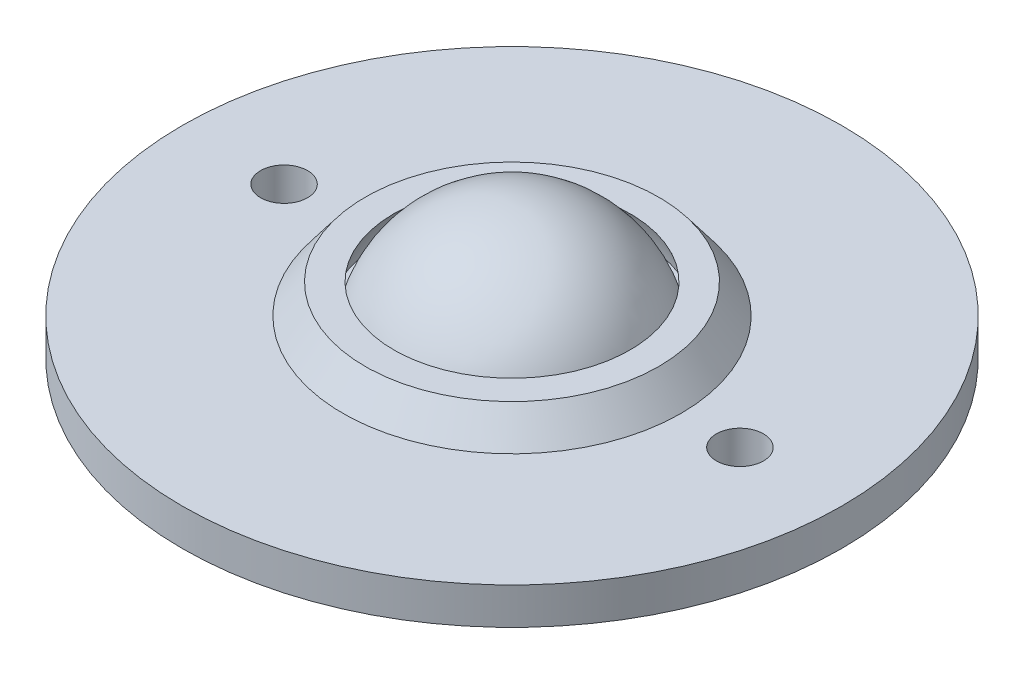
from build123d import *

# Parameters (mm, degrees)
SKETCH_2_R          = 1.6
CUT_EXTRUDE_1_DEPTH = 10


with BuildPart() as part:
    # 草图1 → 旋转5 (revolve)
    with BuildSketch(Plane.XY):
        with BuildLine():
            Line((-11.5, 0.961485209), (-22.420203846, 0.961485209))
            Line((-22.420203846, 0.961485209), (-22.420203846, -1.538514791))
            Line((-22.420203846, -1.538514791), (-12.404957567, -1.538514791))
            ThreePointArc((-12.404957567, -1.538514791), (-8.277033439, -9.367001518), (0, -12.5))
            Line((0, -12.5), (0, 0.961485209))
            Line((0, 0.961485209), (-8.348478365, 0.961485209))
            Line((-8.348478365, 0.961485209), (-8.760960883, 0.961485209))
            ThreePointArc((-8.760960883, 0.961485209), (-8.455804212, 1.983114098), (-8.031969161, 2.961485209))
            Line((-8.031969161, 2.961485209), (-9.978754751, 2.961485209))
            Line((-9.978754751, 2.961485209), (-11.5, 0.961485209))
        make_face()
    revolve(axis=Axis((0, 0, 0), (0, 1, 0)))

    # 草图1<6> → 旋转8 (revolve)
    with BuildSketch(Plane.XY):
        with BuildLine():
            Line((0, 7.5), (0, 0.961485209))
            Line((0, 0.961485209), (8.348478365, 0.961485209))
            ThreePointArc((8.348478365, 0.961485209), (5.302104928, 5.670819301), (0, 7.5))
        make_face()
    revolve(axis=Axis((0, 0, 0), (0, 1, 0)))

    # 草图2 → 切除-拉伸1 (cut)
    with BuildSketch(Plane(origin=(0, 0.961485209, 0), x_dir=(1, 0, 0), z_dir=(0, 1, 0))):
        with Locations((-15.5, 0)):
            Circle(SKETCH_2_R)
        with Locations((15.5, 0)):
            Circle(SKETCH_2_R)
    extrude(amount=-CUT_EXTRUDE_1_DEPTH, mode=Mode.SUBTRACT)


solid = part.part
